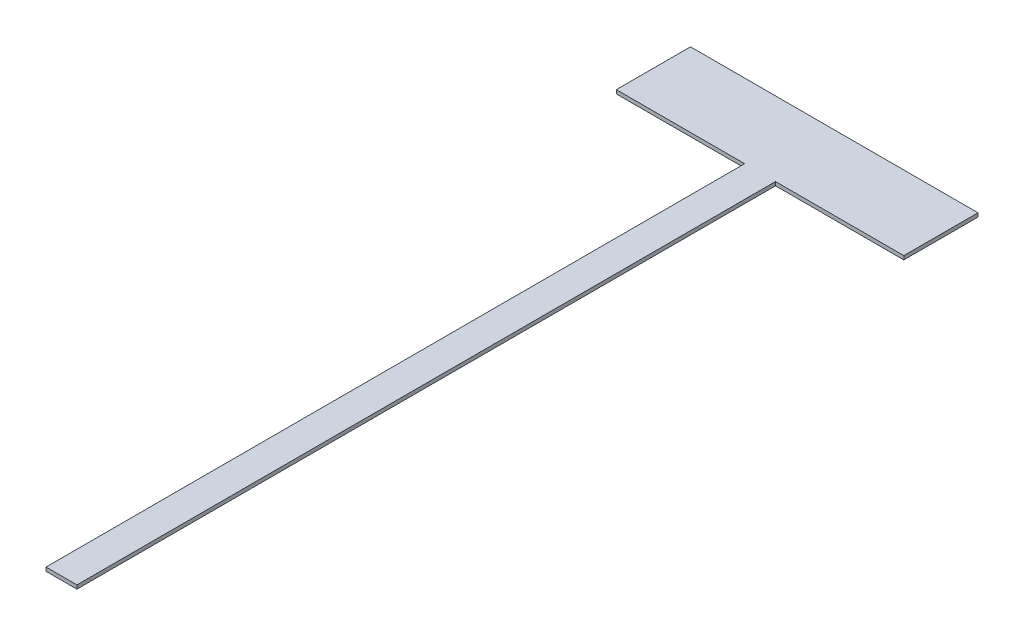
from build123d import *

# Parameters (mm, degrees)
BOSS_EXTRUDE1_DEPTH = 1.2


with BuildPart() as part:
    # Sketch1 → Boss-Extrude1 (new body)
    with BuildSketch(Plane(origin=(0, 0, 0), x_dir=(1, 0, 0), z_dir=(0, 1, 0))):
        Polygon((-46.5, 24), (-46.5, 0), (-5, 0), (-5, -226), (5, -226), (5, 0), (46.5, 0), (46.5, 24), align=None)
    extrude(amount=BOSS_EXTRUDE1_DEPTH)


solid = part.part
